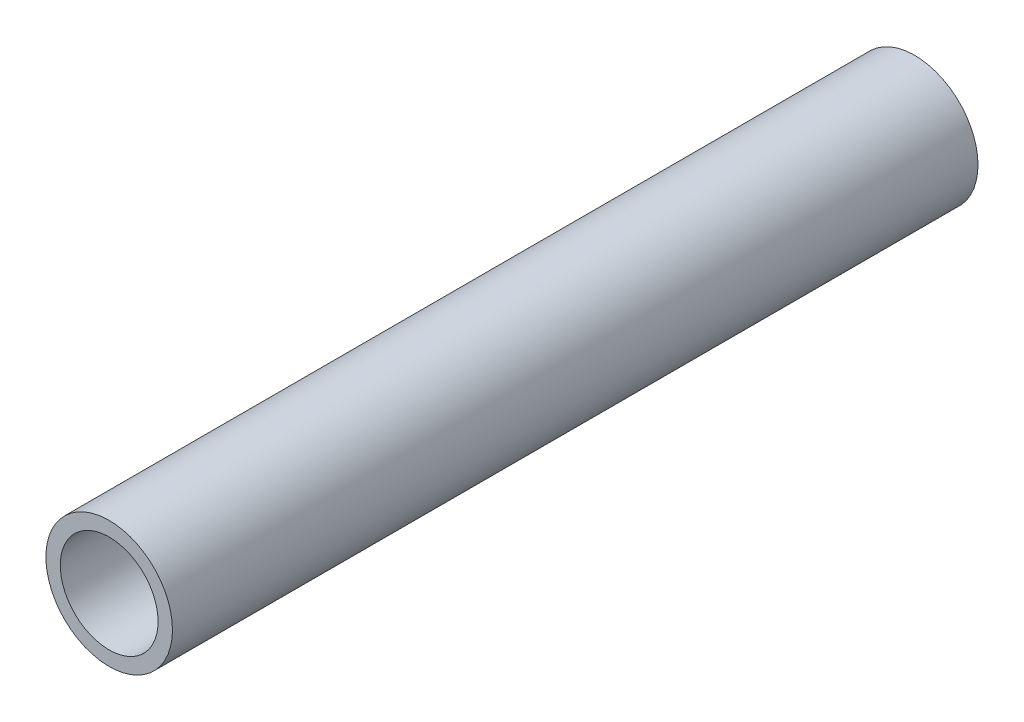
from build123d import *

# Parameters (mm, degrees)
SKETCH1_R           = 11
SKETCH1_R_2         = 8.5
BOSS_EXTRUDE1_DEPTH = 140


with BuildPart() as part:
    # Sketch1 → Boss-Extrude1 (new body)
    with BuildSketch(Plane.XY):
        Circle(SKETCH1_R)
        Circle(SKETCH1_R_2, mode=Mode.SUBTRACT)
    extrude(amount=BOSS_EXTRUDE1_DEPTH)


solid = part.part
